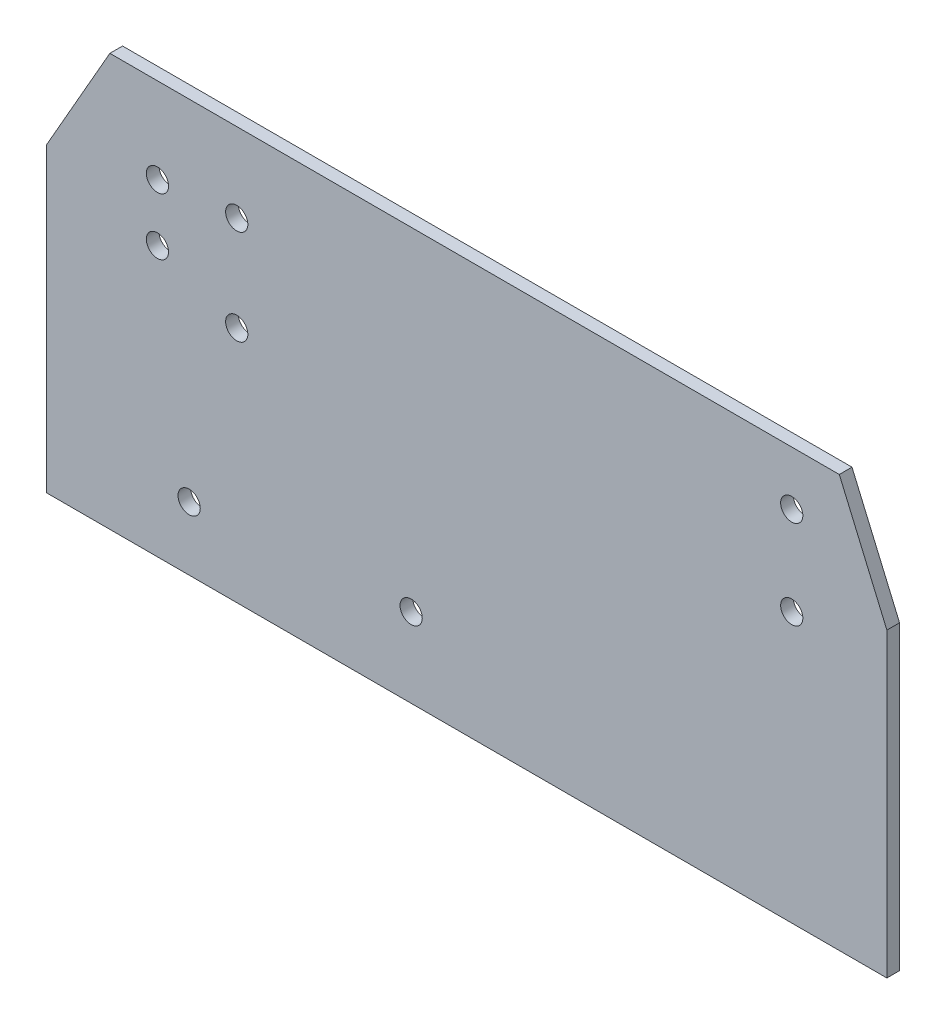
from build123d import *

# Parameters (mm, degrees)
SKETCH_1_R      = 3.5
EXTRUDE_1_DEPTH = 2


with BuildPart() as part:
    # 草图1 → 凸台-拉伸1 (new, symmetric)
    with BuildSketch(Plane.XY):
        Polygon((-115, -25), (150, -25), (150, 70), (135, 105), (-95, 105), (-115, 70), align=None)
        Circle(SKETCH_1_R, mode=Mode.SUBTRACT)
        with Locations((-80, 60)):
            Circle(SKETCH_1_R, mode=Mode.SUBTRACT)
        with Locations((120, 60)):
            Circle(SKETCH_1_R, mode=Mode.SUBTRACT)
        with Locations((-70, -5)):
            Circle(SKETCH_1_R, mode=Mode.SUBTRACT)
        with Locations((-55, 50)):
            Circle(SKETCH_1_R, mode=Mode.SUBTRACT)
        with Locations((-55, 80)):
            Circle(SKETCH_1_R, mode=Mode.SUBTRACT)
        with Locations((120, 88)):
            Circle(SKETCH_1_R, mode=Mode.SUBTRACT)
        with Locations((-80, 78)):
            Circle(SKETCH_1_R, mode=Mode.SUBTRACT)
    extrude(amount=EXTRUDE_1_DEPTH, both=True)


solid = part.part
